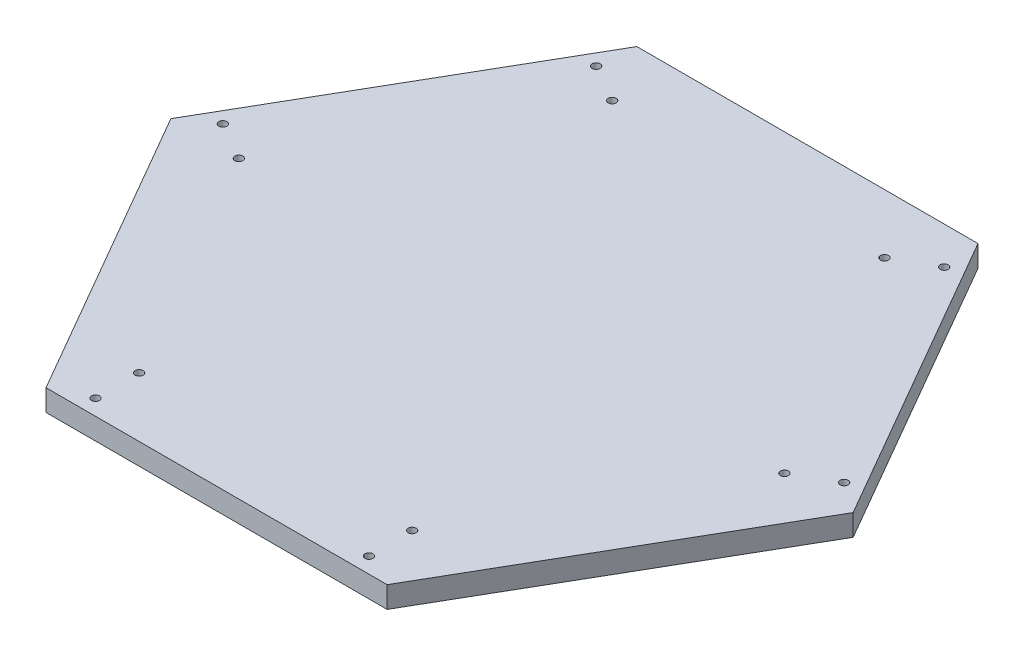
from build123d import *

# Parameters (mm, degrees)
BOSS_EXTRUDE2_DEPTH = 8
SKETCH2_R           = 1.5
CUT_EXTRUDE1_DEPTH  = 211.61424354


with BuildPart() as part:
    # Sketch1 → Boss-Extrude2 (new body)
    with BuildSketch(Plane(origin=(0, 0, 0), x_dir=(1, 0, 0), z_dir=(0, 1, 0))):
        Polygon((94.000414938, -26.09989937), (30.400414938, 84.058531992), (-96.799585062, 84.058531992), (-160.399585062, -26.09989937), (-96.799585062, -136.258330731), (30.400414938, -136.258330731), align=None)
    extrude(amount=BOSS_EXTRUDE2_DEPTH)

    # Sketch2 → Cut-Extrude1 (cut, through all)
    with BuildSketch(Plane(origin=(0, 8, 0), x_dir=(1, 0, 0), z_dir=(0, 1, 0))):
        with Locations(Location((17.780367394, -130.408330731, 0), (0, 0, 270))):
            Circle(SKETCH2_R)
        with Locations(Location((-84.179537519, -130.408330731, 0), (0, 0, 270))):
            Circle(SKETCH2_R)
        with Locations(Location((-84.221416865, -114.108384531, 0), (0, 0, 270))):
            Circle(SKETCH2_R)
        with Locations(Location((17.566684484, -114.109731417, 0), (0, 0, 270))):
            Circle(SKETCH2_R)
        with Locations(Location((82.624142554, -18.0956176, 0), (0, 0, 270))):
            Circle(SKETCH2_R)
        with Locations(Location((68.507928472, -26.2456176, 0), (0, 0, 270))):
            Circle(SKETCH2_R)
        with Locations(Location((31.676359033, 70.148531992, 0), (0, 0, 270))):
            Circle(SKETCH2_R)
        with Locations(Location((17.560144951, 61.998531992, 0), (0, 0, 270))):
            Circle(SKETCH2_R)
        with Locations(Location((-98.075529157, 70.148531992, 0), (0, 0, 270))):
            Circle(SKETCH2_R)
        with Locations(Location((-83.959315075, 61.998531992, 0), (0, 0, 270))):
            Circle(SKETCH2_R)
        with Locations(Location((-149.023312678, -18.0956176, 0), (0, 0, 270))):
            Circle(SKETCH2_R)
        with Locations(Location((-134.907098597, -26.2456176, 0), (0, 0, 270))):
            Circle(SKETCH2_R)
    extrude(amount=-CUT_EXTRUDE1_DEPTH, mode=Mode.SUBTRACT)


solid = part.part
